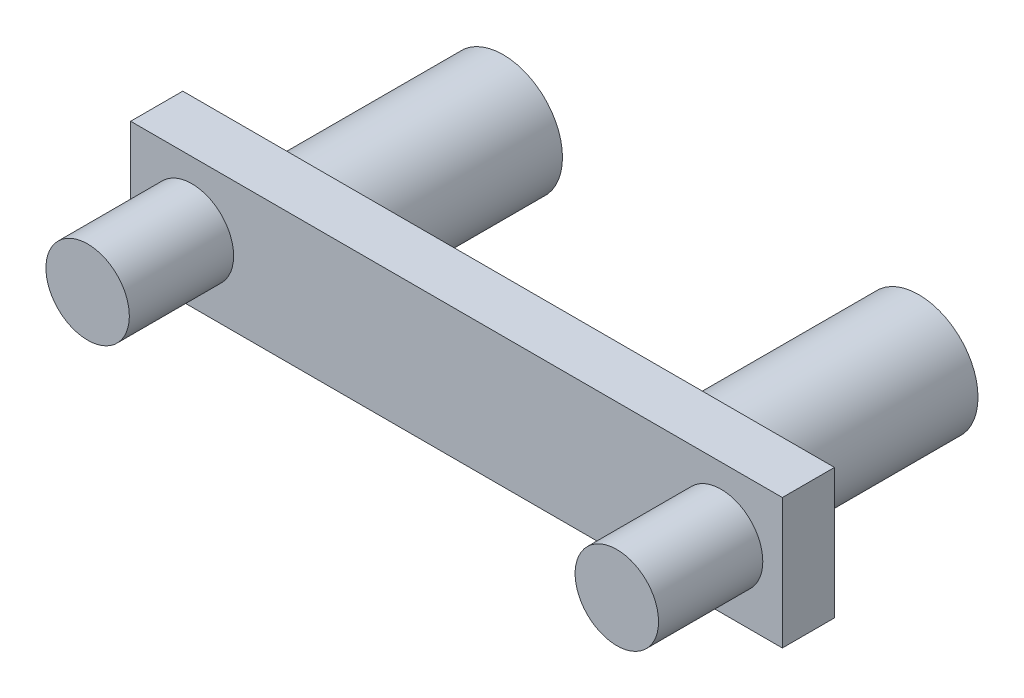
from build123d import *

# Parameters (mm, degrees)
SKETCH1_W           = 25
SKETCH1_H           = 5
BOSS_EXTRUDE1_DEPTH = 2
SKETCH2_R           = 1.6
BOSS_EXTRUDE2_DEPTH = 4
SKETCH3_R           = 2.275
SKETCH3_R_2         = 1.6
BOSS_EXTRUDE3_DEPTH = 7.76


with BuildPart() as part:
    # Sketch1 → Boss-Extrude1 (new body)
    with BuildSketch(Plane.XY):
        with Locations((12.5, 2.5)):
            Rectangle(SKETCH1_W, SKETCH1_H)
    extrude(amount=BOSS_EXTRUDE1_DEPTH)

    # Sketch2 → Boss-Extrude2 (add)
    with BuildSketch(Plane.XY.offset(2)):
        with Locations((2.35, 2.5)):
            Circle(SKETCH2_R)
        with Locations((22.65, 2.5)):
            Circle(SKETCH2_R)
    extrude(amount=BOSS_EXTRUDE2_DEPTH)

    # Sketch3 → Boss-Extrude3 (add)
    # profile 1 of 2: a face of its own
    with BuildSketch(Plane(origin=(0, 0, 0), x_dir=(-1, 0, 0), z_dir=(0, 0, -1))):
        with Locations(Location((-20.47, 2.322974485, 0), (0, 0, 180))):
            Circle(SKETCH3_R)
        with Locations((-20.47, 2.322974485)):
            Circle(SKETCH3_R_2, mode=Mode.SUBTRACT)
    # profile 2 of 2: a face of its own
    with BuildSketch(Plane(origin=(0, 0, 0), x_dir=(-1, 0, 0), z_dir=(0, 0, -1))):
        with Locations(Location((-4.53, 2.322974485, 0), (0, 0, 180))):
            Circle(SKETCH3_R)
        with Locations((-4.53, 2.322974485)):
            Circle(SKETCH3_R_2, mode=Mode.SUBTRACT)
    extrude(amount=BOSS_EXTRUDE3_DEPTH)


solid = part.part
